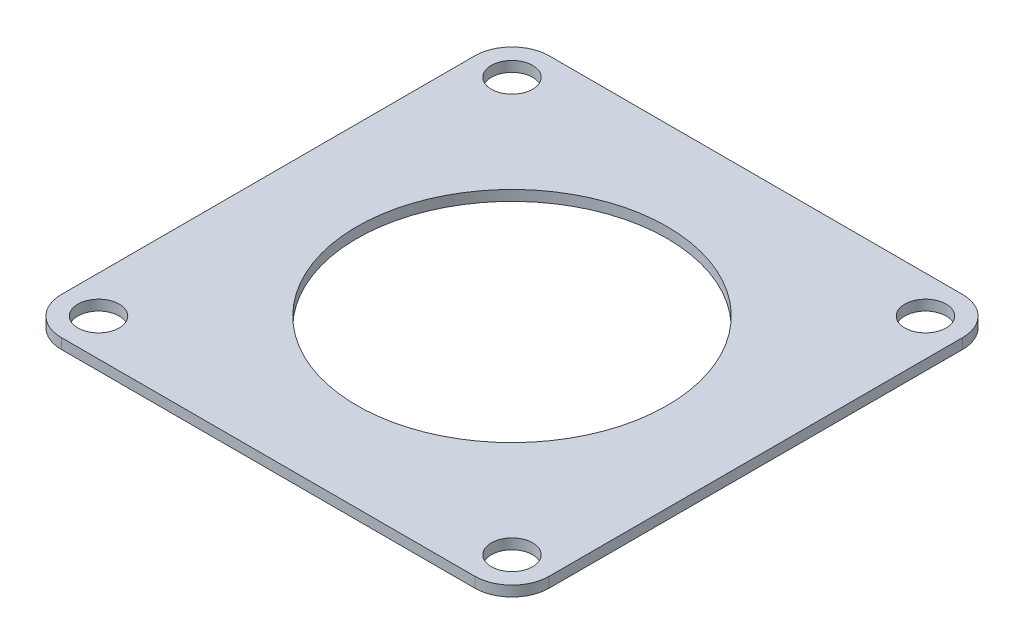
from build123d import *

# Parameters (mm, degrees)
SKETCH_1_R          = 10
EXTRUDE_1_DEPTH     = 5
SKETCH_2_R          = 75
CUT_EXTRUDE_1_DEPTH = 167.952088936


with BuildPart() as part:
    # 草图1 → 凸台-拉伸1 (new body)
    with BuildSketch(Plane(origin=(0, 0, 0), x_dir=(1, 0, 0), z_dir=(0, 1, 0))):
        with BuildLine():
            Line((-100, 118), (100, 118))
            ThreePointArc((100, 118), (112.727922061, 112.727922061), (118, 100))
            Line((118, 100), (118, -100))
            ThreePointArc((118, -100), (112.727922061, -112.727922061), (100, -118))
            Line((100, -118), (-100, -118))
            ThreePointArc((-100, -118), (-112.727922061, -112.727922061), (-118, -100))
            Line((-118, -100), (-118, 100))
            ThreePointArc((-118, 100), (-112.727922061, 112.727922061), (-100, 118))
        make_face()
        with Locations(Location((100, 100, 0), (0, 0, 270))):
            Circle(SKETCH_1_R, mode=Mode.SUBTRACT)
        with Locations(Location((100, -100, 0), (0, 0, 270))):
            Circle(SKETCH_1_R, mode=Mode.SUBTRACT)
        with Locations(Location((-100, -100, 0), (0, 0, 270))):
            Circle(SKETCH_1_R, mode=Mode.SUBTRACT)
        with Locations(Location((-100, 100, 0), (0, 0, 270))):
            Circle(SKETCH_1_R, mode=Mode.SUBTRACT)
    extrude(amount=EXTRUDE_1_DEPTH)

    # 草图2 → 切除-拉伸1 (cut, through all)
    with BuildSketch(Plane.XZ):
        with Locations(Location((0, 0, 0), (0, 0, 270))):
            Circle(SKETCH_2_R)
    extrude(amount=-CUT_EXTRUDE_1_DEPTH, mode=Mode.SUBTRACT)


solid = part.part
